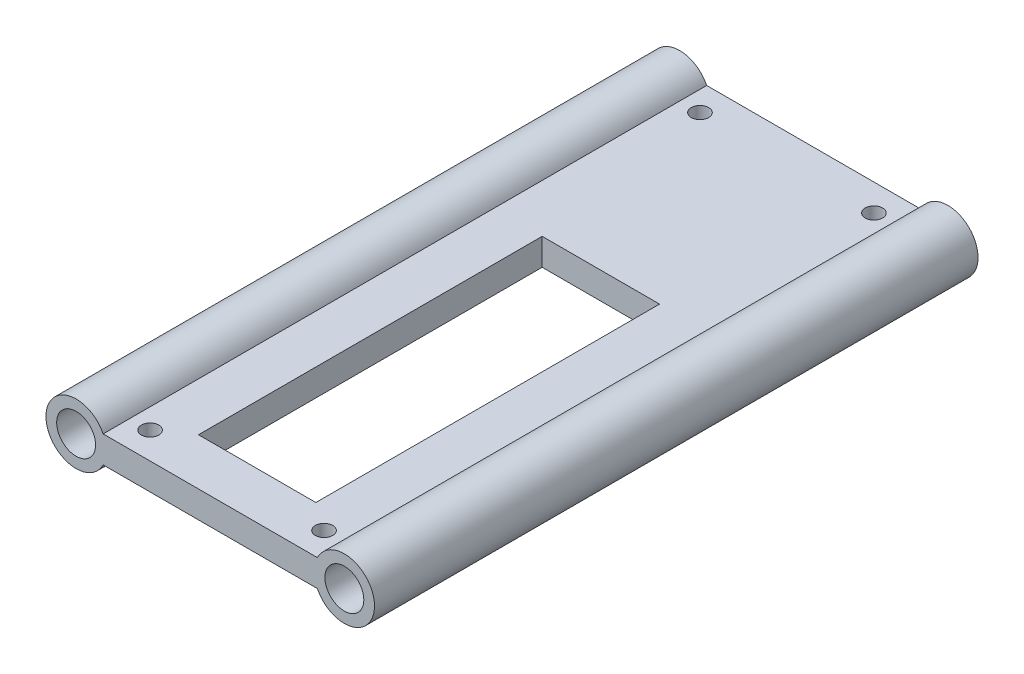
from build123d import *

# Parameters (mm, degrees)
SKETCH1_R           = 3.683
BOSS_EXTRUDE1_DEPTH = 114.3
SKETCH2_R           = 1.651
SKETCH2_W           = 22.225
SKETCH2_H           = 65.0875
CUT_EXTRUDE1_DEPTH  = 114.3


with BuildPart() as part:
    # Sketch1 → Boss-Extrude1 (new body)
    with BuildSketch(Plane.XY):
        with BuildLine():
            ThreePointArc((-20.28046633, 2.54), (-31.115, 0), (-20.28046633, -2.54))
            Line((-20.28046633, -2.54), (20.28046633, -2.54))
            ThreePointArc((20.28046633, -2.54), (31.115, 0), (20.28046633, 2.54))
            Line((20.28046633, 2.54), (-20.28046633, 2.54))
        make_face()
        with Locations((-25.4, 0)):
            Circle(SKETCH1_R, mode=Mode.SUBTRACT)
        with Locations((25.4, 0)):
            Circle(SKETCH1_R, mode=Mode.SUBTRACT)
    extrude(amount=-BOSS_EXTRUDE1_DEPTH)

    # Sketch2 → Cut-Extrude1 (cut)
    with BuildSketch(Plane(origin=(0, 2.54, 0), x_dir=(1, 0, 0), z_dir=(0, 1, 0))):
        with Locations(Location((-16.47046633, 109.22, 0), (0, 0, 270))):
            Circle(SKETCH2_R)
        with Locations(Location((16.47046633, 109.22, 0), (0, 0, 270))):
            Circle(SKETCH2_R)
        with Locations(Location((-16.47046633, 5.08, 0), (0, 0, 270))):
            Circle(SKETCH2_R)
        with Locations(Location((16.47046633, 5.08, 0), (0, 0, 270))):
            Circle(SKETCH2_R)
        with Locations((0, 41.43375)):
            Rectangle(SKETCH2_W, SKETCH2_H)
    extrude(amount=-CUT_EXTRUDE1_DEPTH, mode=Mode.SUBTRACT)


solid = part.part
